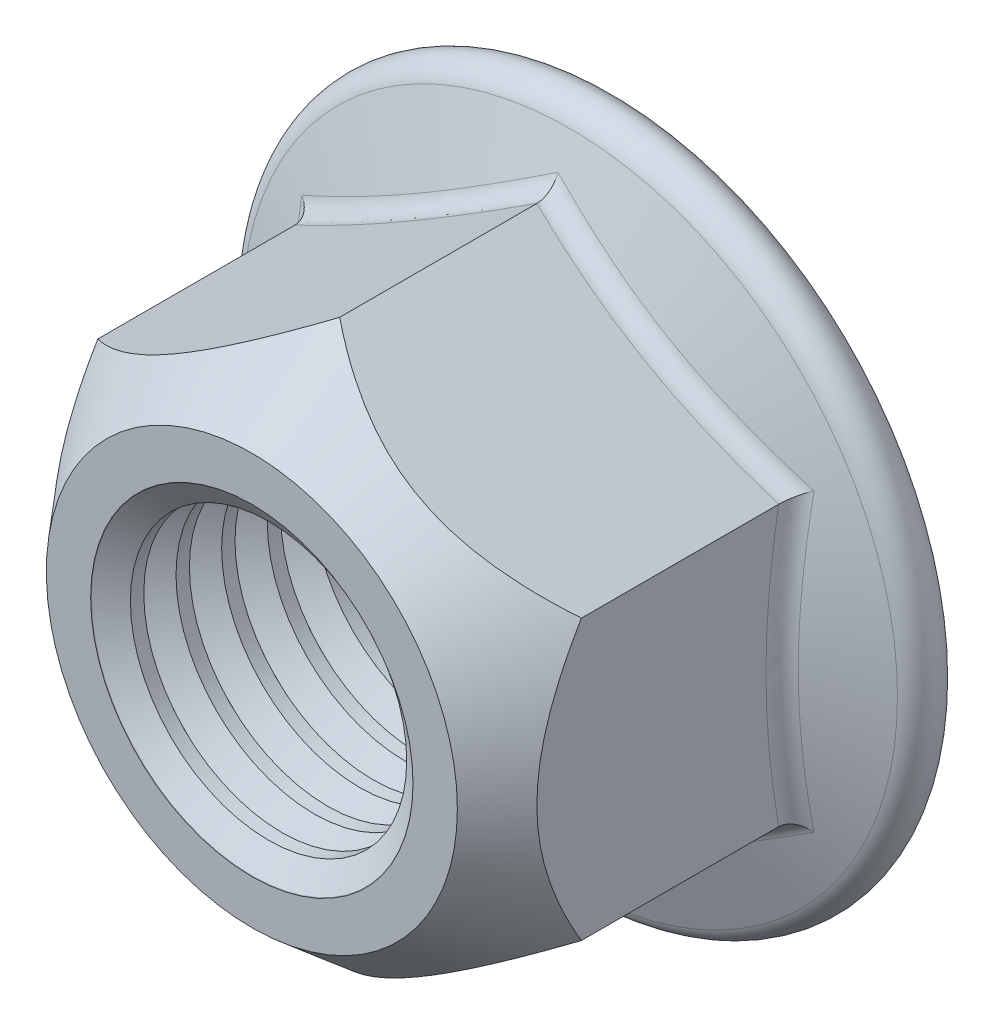
from build123d import *

# Parameters (mm, degrees)
BASENUT_START   = -15.9
BASENUTSKE_R    = 6
BASENUT_DEPTH   = 15.9
FLANGEFILLET_R  = 0.88
THDSCHPAT_COUNT = 8
THDSCHPAT_PITCH = 1.98115


with BuildPart() as part:
    # BaseNutSke → BaseNut (new body)
    with BuildSketch(Plane.XY.offset(BASENUT_START)):
        Polygon((10.5, 6.062177826), (10.5, -6.062177826), (0, -12.124355653), (-10.5, -6.062177826), (-10.5, 6.062177826), (0, 12.124355653), align=None)
        Circle(BASENUTSKE_R, mode=Mode.SUBTRACT)
    extrude(amount=BASENUT_DEPTH)

    # Sketch6 → Flange (revolve)
    with BuildSketch(Plane(origin=(0, 0, 0), x_dir=(0, 0, -1), z_dir=(1, 0, 0)), mode=Mode.PRIVATE) as flange_sk:
        with BuildLine():
            Line((10.801743914, 6), (13.8, 14.237640895))
            ThreePointArc((13.8, 14.237640895), (15.0053537, 14.933552178), (15.9, 13.867354236))
            Line((15.9, 13.867354236), (15.9, 6))
            Line((15.9, 6), (10.801743914, 6))
        make_face()
    revolve(flange_sk.sketch.rotate(Axis((0, 0, 0), (0, 0, -1)), 90), axis=Axis((0, 0, 0), (0, 0, -1)))

    # Sketch3 → Double-Chamfer (revolve, cut)
    with BuildSketch(Plane(origin=(0, 0, 0), x_dir=(0, 0, -1), z_dir=(1, 0, 0)), mode=Mode.PRIVATE) as double_chamfer_sk:
        Polygon((3.812843593, 24.824355653), (-12.7, 24.824355653), (-12.7, 8.925), (0, 8.925), (3.812843593, 12.124355653), align=None)
    revolve(double_chamfer_sk.sketch.rotate(Axis((0, 0, 0), (0, 0, -1)), 300.000000044), axis=Axis((0, 0, 0), (0, 0, -1)), mode=Mode.SUBTRACT)

    # FlangeFillet
    flangefillet_edges = [part.edges().sort_by_distance(p)[0] for p in [
        (10.5, 3.044311508, -12.596998401),
        (5.25, 9.09326674, -12.439609968),
        (-5.25, 9.09326674, -12.439609968),
        (-10.5, 0, -12.439609968),
        (-5.25, -9.09326674, -12.439609968),
        (5.25, -9.09326674, -12.439609968),
        (10.5, -3.044311508, -12.596998401),
    ]]
    fillet(flangefillet_edges, radius=FLANGEFILLET_R)

    # Sketch5 → EndChamfer (revolve, cut)
    with BuildSketch(Plane(origin=(0, 0, 0), x_dir=(0, 0, -1), z_dir=(1, 0, 0)), mode=Mode.PRIVATE) as endchamfer_sk:
        Polygon((15.8746, 7), (15.104371708, 5.9), (15.9254, 5.9), (15.9254, 7), align=None)
        Polygon((-0.0508, 7), (0, 7), (0.770228292, 5.9), (-0.0508, 5.9), align=None)
    revolve(endchamfer_sk.sketch.rotate(Axis((0, 0, -25.037505729), (0, 0, -1)), 90), axis=Axis((0, 0, -25.037505729), (0, 0, -1)), mode=Mode.SUBTRACT)

    # ThdSchSke → ThreadSchematic (revolve, cut)
    with BuildSketch(Plane(origin=(0, 0, 0), x_dir=(1, 0, 0), z_dir=(0, 1, 0))):
        Polygon((-7, 0.0254), (-6, 0.725607538), (-3, 0.725607538), (-3, -0.674807538), (-6, -0.674807538), align=None)
    threadschematic = revolve(axis=Axis((0, 0, -2), (0, 0, 1)), mode=Mode.SUBTRACT)

    # ThdSchPat: ThreadSchematic ×8
    with Locations(*[(0, 0, -i * THDSCHPAT_PITCH) for i in range(1, THDSCHPAT_COUNT)]):
        add(threadschematic, mode=Mode.SUBTRACT)


solid = part.part
